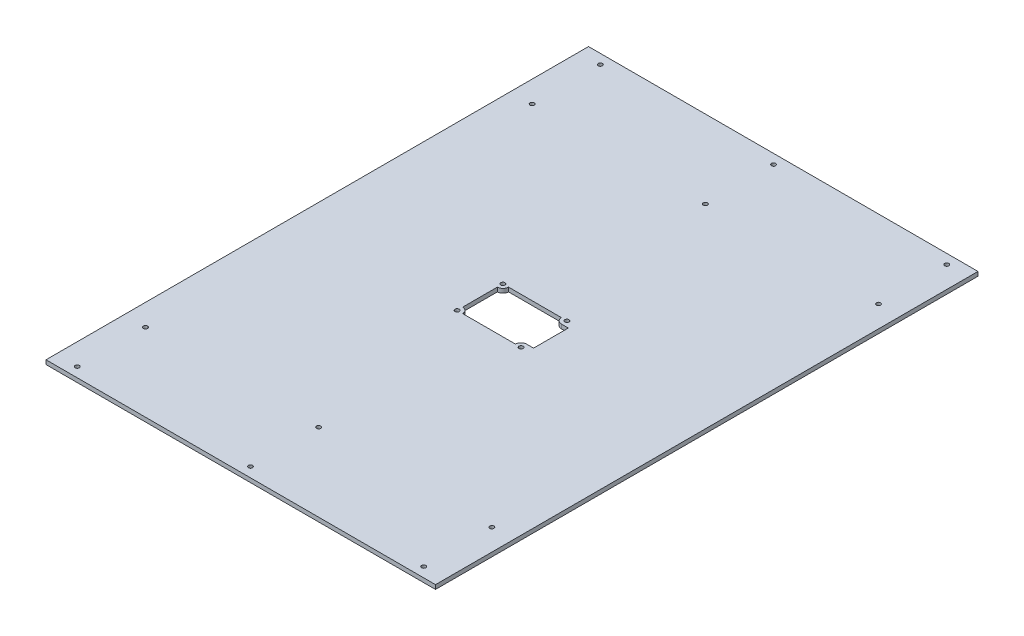
from build123d import *

# Parameters (mm, degrees)
SKETCH_1_W          = 280
SKETCH_1_H          = 390
EXTRUDE_1_DEPTH     = 3
SKETCH_2_R          = 1.5
CUT_EXTRUDE_1_DEPTH = 481.113528241
SKETCH_3_R          = 1.5
CUT_EXTRUDE_2_DEPTH = 481.113528241
CUT_EXTRUDE_5_DEPTH = 481.113528241
SKETCH_7_W          = 5
SKETCH_7_H          = 25
CUT_EXTRUDE_6_DEPTH = 481.113528241


with BuildPart() as part:
    # 草图1 → 凸台-拉伸1 (new body)
    with BuildSketch(Plane(origin=(0, 0, 0), x_dir=(1, 0, 0), z_dir=(0, 1, 0))):
        with Locations((140, 195)):
            Rectangle(SKETCH_1_W, SKETCH_1_H)
    extrude(amount=EXTRUDE_1_DEPTH)

    # 草图2 → 切除-拉伸1 (cut, through all)
    with BuildSketch(Plane(origin=(0, 3, 0), x_dir=(1, 0, 0), z_dir=(0, 1, 0))):
        with Locations(Location((140, 383, 0), (0, 0, 270))):
            Circle(SKETCH_2_R)
        with Locations(Location((140, 334, 0), (0, 0, 270))):
            Circle(SKETCH_2_R)
        with Locations(Location((264.5, 383, 0), (0, 0, 270))):
            Circle(SKETCH_2_R)
        with Locations(Location((264.5, 334, 0), (0, 0, 270))):
            Circle(SKETCH_2_R)
        with Locations(Location((15.5, 383, 0), (0, 0, 90))):
            Circle(SKETCH_2_R)
        with Locations(Location((15.5, 334, 0), (0, 0, 90))):
            Circle(SKETCH_2_R)
        with Locations(Location((264.5, 56, 0), (0, 0, 90))):
            Circle(SKETCH_2_R)
        with Locations(Location((264.5, 7, 0), (0, 0, 90))):
            Circle(SKETCH_2_R)
        with Locations(Location((140, 7, 0), (0, 0, 90))):
            Circle(SKETCH_2_R)
        with Locations(Location((140, 56, 0), (0, 0, 90))):
            Circle(SKETCH_2_R)
        with Locations(Location((15.5, 56, 0), (0, 0, 270))):
            Circle(SKETCH_2_R)
        with Locations(Location((15.5, 7, 0), (0, 0, 270))):
            Circle(SKETCH_2_R)
    extrude(amount=-CUT_EXTRUDE_1_DEPTH, mode=Mode.SUBTRACT)

    # 草图3 → 切除-拉伸2 (cut, through all)
    with BuildSketch(Plane(origin=(0, 3, 0), x_dir=(1, 0, 0), z_dir=(0, 1, 0))):
        with Locations(Location((117, 211.5, 0), (0, 0, 270))):
            Circle(SKETCH_3_R)
        with Locations(Location((163, 211.5, 0), (0, 0, 270))):
            Circle(SKETCH_3_R)
        with Locations(Location((163, 178.5, 0), (0, 0, 270))):
            Circle(SKETCH_3_R)
        with Locations(Location((117, 178.5, 0), (0, 0, 270))):
            Circle(SKETCH_3_R)
    extrude(amount=-CUT_EXTRUDE_2_DEPTH, mode=Mode.SUBTRACT)

    # 草图6 → 切除-拉伸5 (cut, through all)
    with BuildSketch(Plane(origin=(0, 3, 0), x_dir=(1, 0, 0), z_dir=(0, 1, 0))):
        with BuildLine():
            Line((121, 211.5), (159, 211.5))
            ThreePointArc((159, 211.5), (160.171572875, 208.671572875), (163, 207.5))
            Line((163, 207.5), (163, 182.5))
            ThreePointArc((163, 182.5), (160.171572875, 181.328427125), (159, 178.5))
            Line((159, 178.5), (121, 178.5))
            ThreePointArc((121, 178.5), (119.828427125, 181.328427125), (117, 182.5))
            Line((117, 182.5), (117, 207.5))
            ThreePointArc((117, 207.5), (119.828427125, 208.671572875), (121, 211.5))
        make_face()
    extrude(amount=-CUT_EXTRUDE_5_DEPTH, mode=Mode.SUBTRACT)

    # 草图7 → 切除-拉伸6 (cut, through all)
    with BuildSketch(Plane(origin=(0, 3, 0), x_dir=(1, 0, 0), z_dir=(0, 1, 0))):
        with Locations((165.5, 195)):
            Rectangle(SKETCH_7_W, SKETCH_7_H)
    extrude(amount=-CUT_EXTRUDE_6_DEPTH, mode=Mode.SUBTRACT)


solid = part.part
